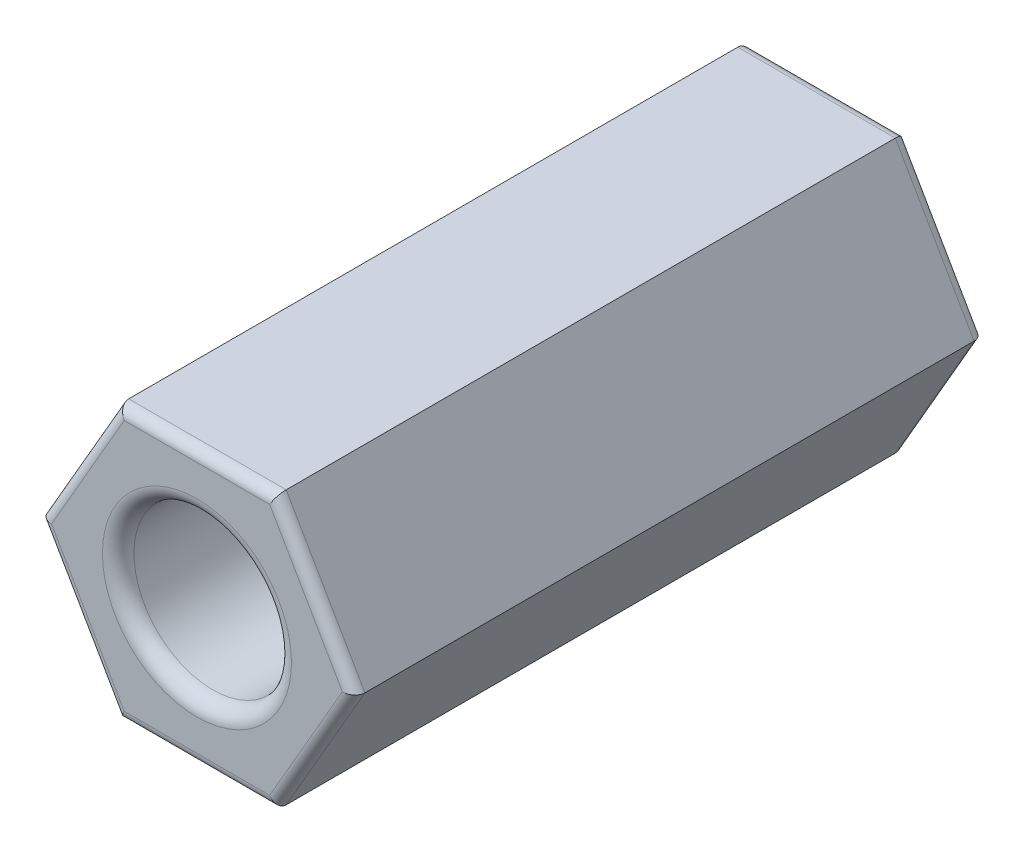
from build123d import *

# Parameters (mm, degrees)
SKETCH1_R           = 1.5
BOSS_EXTRUDE1_DEPTH = 12
FILLET1_R           = 0.3
FILLET2_R           = 0.2


with BuildPart() as part:
    # Sketch1 → Boss-Extrude1 (new body)
    with BuildSketch(Plane.XY):
        Polygon((3, 0), (1.5, 2.598076211), (-1.5, 2.598076211), (-3, 0), (-1.5, -2.598076211), (1.5, -2.598076211), align=None)
        Circle(SKETCH1_R, mode=Mode.SUBTRACT)
    extrude(amount=BOSS_EXTRUDE1_DEPTH)

    # Fillet1
    fillet1_edges = [part.edges().sort_by_distance(p)[0] for p in [
        (-1.5, 0, 0),
        (-1.5, 0, 12),
    ]]
    fillet(fillet1_edges, radius=FILLET1_R)

    # Fillet2
    fillet2_edges = [part.edges().sort_by_distance(p)[0] for p in [
        (0, 2.598076211, 12),
        (-2.25, 1.299038106, 12),
        (-2.25, -1.299038106, 12),
        (0, -2.598076211, 12),
        (2.25, -1.299038106, 12),
        (0, -2.598076211, 0),
        (-2.25, -1.299038106, 0),
        (-2.25, 1.299038106, 0),
        (2.25, 1.299038106, 12),
        (0, 2.598076211, 0),
        (2.25, 1.299038106, 0),
        (2.25, -1.299038106, 0),
    ]]
    fillet(fillet2_edges, radius=FILLET2_R)


solid = part.part
